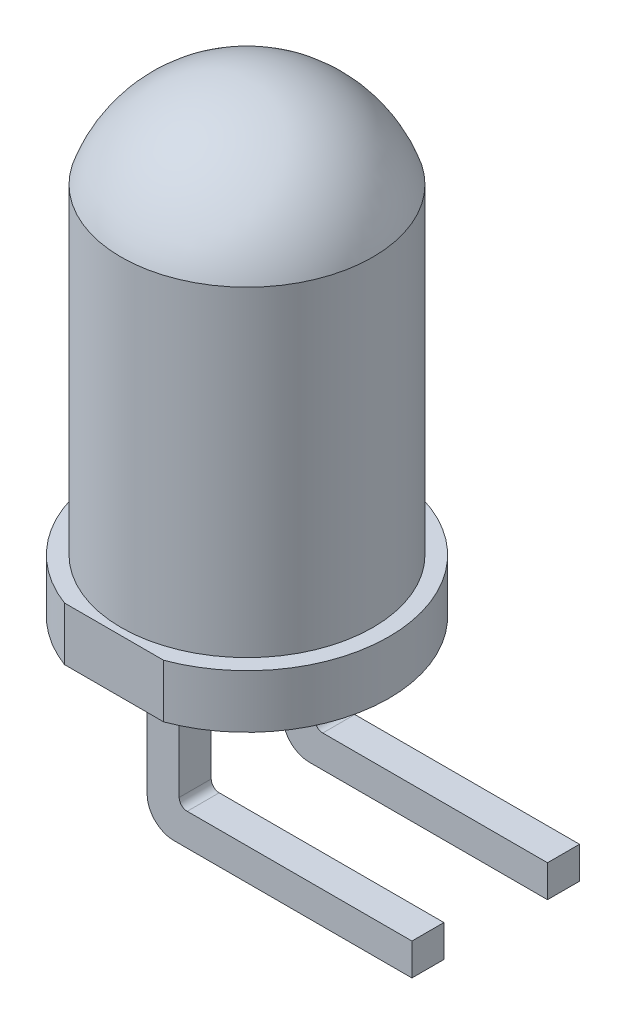
from build123d import *

# Parameters (mm, degrees)
IZIM2_W                     = 2
IZIM2_H                     = 0.3
KES_EKSTR_ZYON3_DEPTH       = 10
IZIM3_W                     = 0.6
IZIM3_H                     = 0.6
Y_KSEKLIK_EKSTR_ZYON1_DEPTH = 2.75
IZIM4_W                     = 0.6
IZIM4_H                     = 0.6
Y_KSEKLIK_EKSTR_ZYON2_DEPTH = 4.36
RADYUS1_R                   = 0.5
RADYUS2_R                   = 0.15
RADYUS3_R                   = 0.15


with BuildPart() as part:
    # Çizim1 → Döndür1 (revolve)
    with BuildSketch(Plane.XY, mode=Mode.PRIVATE) as d_nd_r1_sk:
        with BuildLine():
            Line((2.357986429, 1), (2.357986429, 7.01))
            ThreePointArc((2.357986429, 7.01), (1.450534384, 8.233870055), (0, 8.7))
            Line((0, 8.7), (0, 1))
            Line((0, 1), (2.357986429, 1))
        make_face()
        Polygon((2.657986429, 1), (2.357986429, 1), (0, 1), (0, 0), (2.657986429, 0), align=None)
    revolve(d_nd_r1_sk.sketch.rotate(Axis((0, 8.7, 0), (0, -1, 0)), 180), axis=Axis((0, 8.7, 0), (0, -1, 0)))

    # Çizim2 → Kes-Ekstrüzyon3 (cut)
    with BuildSketch(Plane(origin=(0, 0, 0), x_dir=(-1, 0, 0), z_dir=(0, -1, 0))):
        with Locations((-0.070058143, -2.64)):
            Rectangle(IZIM2_W, IZIM2_H)
    extrude(amount=-KES_EKSTR_ZYON3_DEPTH, mode=Mode.SUBTRACT)

    # Çizim3 → Yükseklik-Ekstrüzyon1 (add)
    with BuildSketch(Plane.XZ):
        with Locations((0, 1.27)):
            Rectangle(IZIM3_W, IZIM3_H)
        with Locations((0, -1.27)):
            Rectangle(IZIM3_W, IZIM3_H)
    extrude(amount=Y_KSEKLIK_EKSTR_ZYON1_DEPTH)

    # Çizim4 → Yükseklik-Ekstrüzyon2 (add)
    with BuildSketch(Plane(origin=(0.3, 0, 0), x_dir=(0, 0, -1), z_dir=(1, 0, 0))):
        with Locations((-1.27, -2.45)):
            Rectangle(IZIM4_W, IZIM4_H)
        with Locations((1.27, -2.45)):
            Rectangle(IZIM4_W, IZIM4_H)
    extrude(amount=Y_KSEKLIK_EKSTR_ZYON2_DEPTH)

    # Radyus1
    radyus1_edges = [part.edges().sort_by_distance(p)[0] for p in [
        (-0.3, -2.75, 1.27),
        (-0.3, -2.75, -1.27),
    ]]
    fillet(radyus1_edges, radius=RADYUS1_R)

    # Radyus2
    radyus2_edges = [part.edges().sort_by_distance(p)[0] for p in [
        (0.3, -2.15, -1.27),
    ]]
    fillet(radyus2_edges, radius=RADYUS2_R)

    # Radyus3
    radyus3_edges = [part.edges().sort_by_distance(p)[0] for p in [
        (0.3, -2.15, 1.27),
    ]]
    fillet(radyus3_edges, radius=RADYUS3_R)


solid = part.part
